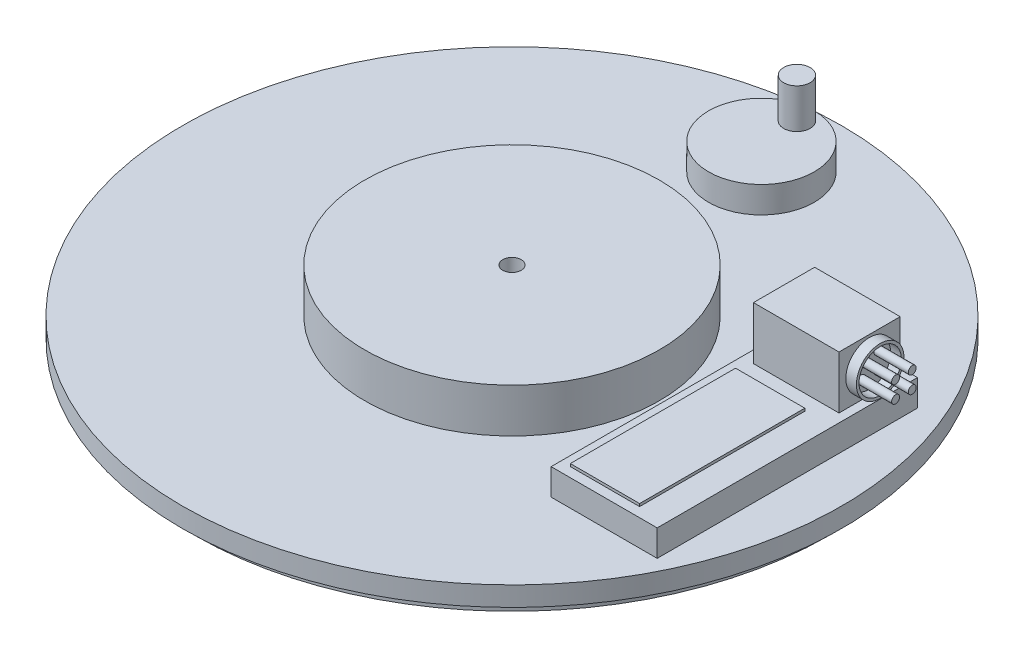
from build123d import *

# Parameters (mm, degrees)
SKETCH2_R           = 20
SKETCH2_W           = 40.133980871
SKETCH2_H           = 98.510680321
BOSS_EXTRUDE1_DEPTH = 10
SKETCH3_W           = 26.229690347
SKETCH3_H           = 62.525074854
BOSS_EXTRUDE2_DEPTH = 1
SKETCH4_R           = 5
BOSS_EXTRUDE3_DEPTH = 15
SKETCH5_W           = 32.37828677
SKETCH5_H           = 23.159469009
BOSS_EXTRUDE4_DEPTH = 20
SKETCH6_R           = 9
SKETCH6_R_2         = 8
BOSS_EXTRUDE5_DEPTH = 4
SKETCH7_R           = 1.505673325
BOSS_EXTRUDE6_DEPTH = 13


with BuildPart() as part:
    # Sketch1 → Revolve2 (revolve)
    with BuildSketch(Plane(origin=(0, 0, 0), x_dir=(0, 0, -1), z_dir=(1, 0, 0)), mode=Mode.PRIVATE) as revolve2_sk:
        Polygon((-124.727272727, 4.929753727), (-120, 4.929753727), (-120, 0.318181818), (-52.5, 0.318181818), (-52.5, 4.929753727), (-50.5, 4.929753727), (-50.5, 12.318181818), (-50.5, 22.651670955), (-3.5, 22.651670955), (-3.5, 28.996436074), (-50.5, 28.996436074), (-55.732846455, 28.996436074), (-55.732846455, 12.318181818), (-124.727272727, 12.318181818), align=None)
    revolve(revolve2_sk.sketch.rotate(Axis((0, -1000, 0), (0, 1, 0)), 180), axis=Axis((0, -1000, 0), (0, 1, 0)))

    # Sketch2 → Boss-Extrude1 (add)
    with BuildSketch(Plane(origin=(0, 12.318181818, 0), x_dir=(1, 0, 0), z_dir=(0, 1, 0))):
        with Locations(Location((0, 94.391996497, 0), (0, 0, 90))):
            Circle(SKETCH2_R)
        with Locations((86.897306122, -2.763043919)):
            Rectangle(SKETCH2_W, SKETCH2_H)
    extrude(amount=BOSS_EXTRUDE1_DEPTH)

    # Sketch3 → Boss-Extrude2 (add)
    with BuildSketch(Plane(origin=(0, 22.318181818, 0), x_dir=(1, 0, 0), z_dir=(0, 1, 0))):
        with Locations((83.554770675, -17.111809319)):
            Rectangle(SKETCH3_W, SKETCH3_H)
    extrude(amount=BOSS_EXTRUDE2_DEPTH)

    # Sketch4 → Boss-Extrude3 (add)
    with BuildSketch(Plane(origin=(0, 22.318181818, 0), x_dir=(1, 0, 0), z_dir=(0, 1, 0))):
        with Locations(Location((0, 107.827495102, 0), (0, 0, 270))):
            Circle(SKETCH4_R)
    extrude(amount=BOSS_EXTRUDE3_DEPTH)

    # Sketch5 → Boss-Extrude4 (add)
    with BuildSketch(Plane(origin=(0, 22.318181818, 0), x_dir=(1, 0, 0), z_dir=(0, 1, 0))):
        with Locations((87.532995765, 31.614032761)):
            Rectangle(SKETCH5_W, SKETCH5_H)
    extrude(amount=BOSS_EXTRUDE4_DEPTH)

    # Sketch6 → Boss-Extrude5 (add)
    with BuildSketch(Plane(origin=(103.72213915, 0, 0), x_dir=(0, 0, -1), z_dir=(1, 0, 0))):
        with Locations(Location((31.614032762, 32.318181818, 0), (0, 0, 180))):
            Circle(SKETCH6_R)
        with Locations((31.614032762, 32.318181818)):
            Circle(SKETCH6_R_2, mode=Mode.SUBTRACT)
    extrude(amount=BOSS_EXTRUDE5_DEPTH)

    # Sketch7 → Boss-Extrude6 (add)
    with BuildSketch(Plane(origin=(103.72213915, 0, 0), x_dir=(0, 0, -1), z_dir=(1, 0, 0))):
        with Locations(Location((34.758166352, 35.526981806, 0), (0, 0, 180))):
            Circle(SKETCH7_R)
        with Locations(Location((28.469899171, 35.526981806, 0), (0, 0, 180))):
            Circle(SKETCH7_R)
        with Locations(Location((34.758166352, 29.10938183, 0), (0, 0, 180))):
            Circle(SKETCH7_R)
        with Locations(Location((28.469899171, 29.10938183, 0), (0, 0, 180))):
            Circle(SKETCH7_R)
    extrude(amount=BOSS_EXTRUDE6_DEPTH)


solid = part.part
